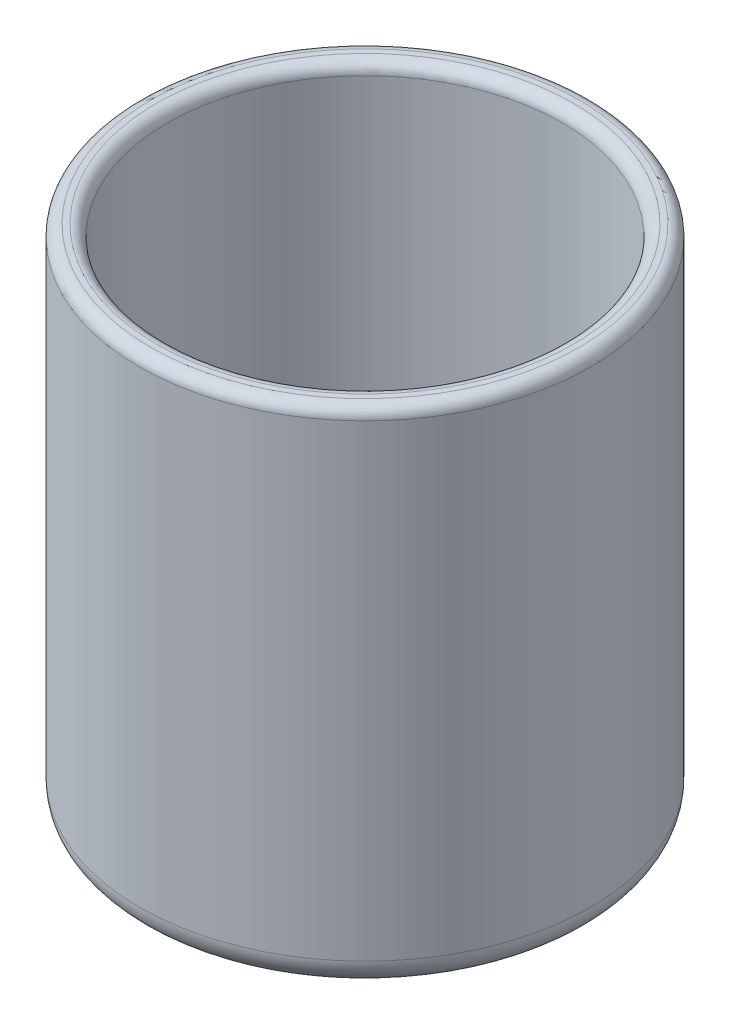
from build123d import *

# Parameters (mm, degrees)
SKETCH1_R           = 40
BOSS_EXTRUDE1_DEPTH = 90
SKETCH2_R           = 35
CUT_EXTRUDE1_DEPTH  = 85
FILLET1_R           = 2
FILLET2_R           = 5


with BuildPart() as part:
    # Sketch1 → Boss-Extrude1 (new body)
    with BuildSketch(Plane(origin=(0, 0, 0), x_dir=(1, 0, 0), z_dir=(0, 1, 0))):
        with Locations(Location((0, 0, 0), (0, 0, 90))):
            Circle(SKETCH1_R)
    extrude(amount=BOSS_EXTRUDE1_DEPTH)

    # Sketch2 → Cut-Extrude1 (cut)
    with BuildSketch(Plane(origin=(0, 90, 0), x_dir=(1, 0, 0), z_dir=(0, 1, 0))):
        with Locations(Location((0, 0, 0), (0, 0, 270))):
            Circle(SKETCH2_R)
    extrude(amount=-CUT_EXTRUDE1_DEPTH, mode=Mode.SUBTRACT)

    # Fillet1
    fillet1_edges = [part.edges().sort_by_distance(p)[0] for p in [
        (0, 90, 40),
        (0, 90, -35),
    ]]
    fillet(fillet1_edges, radius=FILLET1_R)

    # Fillet2
    fillet2_edges = [part.edges().sort_by_distance(p)[0] for p in [
        (0, 0, 40),
        (0, 5, -35),
    ]]
    fillet(fillet2_edges, radius=FILLET2_R)


solid = part.part
